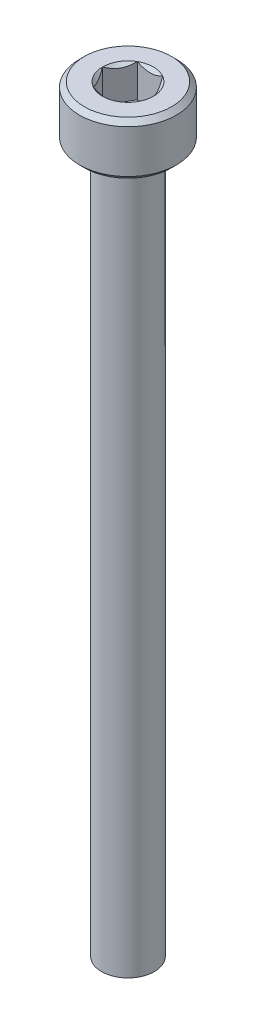
from build123d import *

# Parameters (mm, degrees)
SKETCH1_R           = 2.75
BOSS_EXTRUDE1_DEPTH = 3
CUT_EXTRUDE1_DEPTH  = 1.88
CHAMFER1_SIZE       = 0.275
SKETCH_1_R          = 1.5
EXTRUDE_1_DEPTH     = 40


with BuildPart() as part:
    # Sketch1 → Boss-Extrude1 (new body)
    with BuildSketch(Plane(origin=(0, 0, 0), x_dir=(1, 0, 0), z_dir=(0, 1, 0))):
        with Locations(Location((0, 0, 0), (0, 0, 270))):
            Circle(SKETCH1_R)
    extrude(amount=BOSS_EXTRUDE1_DEPTH)

    # Sketch2 → Cut-Extrude1 (cut)
    with BuildSketch(Plane(origin=(0, 3, 0), x_dir=(1, 0, 0), z_dir=(0, 1, 0))):
        Polygon((0.721687836, 1.25), (-0.721687836, 1.25), (-1.443375673, 0), (-0.721687836, -1.25), (0.721687836, -1.25), (1.443375673, 0), align=None)
    extrude(amount=-CUT_EXTRUDE1_DEPTH, mode=Mode.SUBTRACT)

    # Cut-Extrude2 cone 1 section (through the dimple's axis) → Cut-Extrude2 (revolve, cut)
    with BuildSketch(Plane(origin=(0, 3, 0), x_dir=(0, 0, 1), z_dir=(1, 0, 0))):
        Polygon((0, 0), (1.443375673, 0), (0, 1.443375673), align=None)
    revolve(axis=Axis((0, 3, 0), (0, -1, 0)), mode=Mode.SUBTRACT)

    # Chamfer1
    chamfer1_edges = [part.edges().sort_by_distance(p)[0] for p in [
        (0, 0, -2.75),
        (0, 3, -2.75),
    ]]
    chamfer(chamfer1_edges, length=CHAMFER1_SIZE)

    # 草图1 → 凸台-拉伸1 (add)
    with BuildSketch(Plane(origin=(0, 0, 0), x_dir=(-1, 0, 0), z_dir=(0, -1, 0))):
        with Locations(Location((0, 0, 0), (0, 0, 90))):
            Circle(SKETCH_1_R)
    extrude(amount=EXTRUDE_1_DEPTH)


solid = part.part
